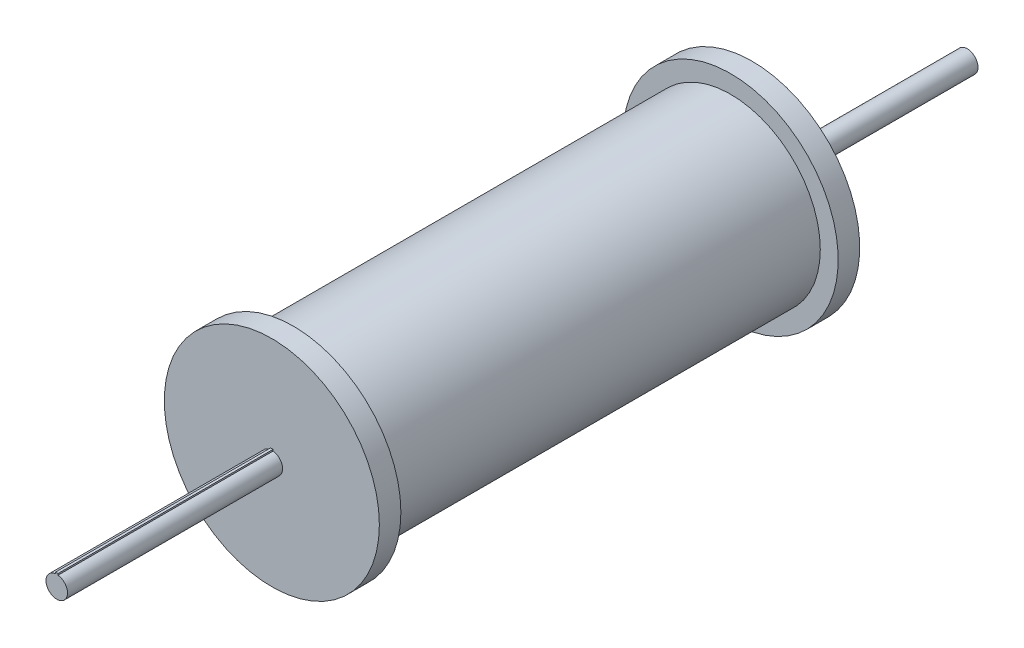
from build123d import *

# Parameters (mm, degrees)
CROQUIS1_R              = 15
SALIENTE_EXTRUIR1_DEPTH = 3
SALIENTE_EXTRUIR2_DEPTH = 30
CROQUIS3_R              = 12.5
SALIENTE_EXTRUIR3_DEPTH = 61
SALIENTE_EXTRUIR4_START = 3
CROQUIS4_R              = 15
SALIENTE_EXTRUIR4_DEPTH = 3
SALIENTE_EXTRUIR5_START = 30
CROQUIS5_R              = 1.5
SALIENTE_EXTRUIR5_DEPTH = 30


with BuildPart() as part:
    # Croquis1 → Saliente-Extruir1 (new body)
    with BuildSketch(Plane.XY):
        Circle(CROQUIS1_R)
    extrude(amount=SALIENTE_EXTRUIR1_DEPTH)

    # Croquis2 → Saliente-Extruir2 (add)
    with BuildSketch(Plane.XY.offset(3)):
        with BuildLine():
            Line((-0.175, 1.489756692), (-0.175, 1.697953704))
            Line((-0.175, 1.697953704), (0.175, 1.697953704))
            Line((0.175, 1.697953704), (0.175, 1.489756692))
            ThreePointArc((0.175, 1.489756692), (0, -1.5), (-0.175, 1.489756692))
        make_face()
    extrude(amount=SALIENTE_EXTRUIR2_DEPTH)

    # Croquis3 → Saliente-Extruir3 (add)
    with BuildSketch(Plane(origin=(0, 0, 0), x_dir=(-1, 0, 0), z_dir=(0, 0, -1))):
        with Locations(Location((0, 0, 0), (0, 0, 180))):
            Circle(CROQUIS3_R)
    extrude(amount=SALIENTE_EXTRUIR3_DEPTH)

    # Croquis4 → Saliente-Extruir4 (add)
    with BuildSketch(Plane(origin=(0, 0, -61), x_dir=(-1, 0, 0), z_dir=(0, 0, -1)).offset(SALIENTE_EXTRUIR4_START)):
        with Locations(Location((0, 0, 0), (0, 0, 180))):
            Circle(CROQUIS4_R)
    extrude(amount=-SALIENTE_EXTRUIR4_DEPTH)

    # Croquis5 → Saliente-Extruir5 (add)
    with BuildSketch(Plane(origin=(0, 0, -64), x_dir=(-1, 0, 0), z_dir=(0, 0, -1)).offset(SALIENTE_EXTRUIR5_START)):
        Circle(CROQUIS5_R)
    extrude(amount=-SALIENTE_EXTRUIR5_DEPTH)


solid = part.part
